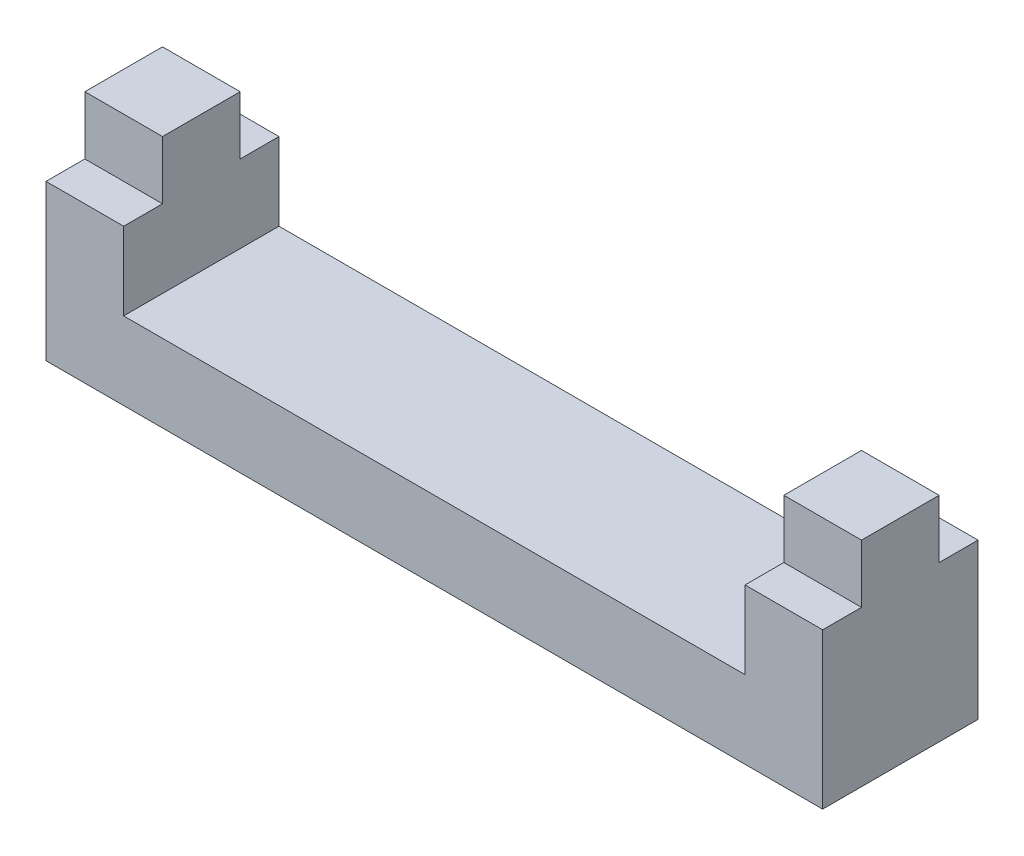
from build123d import *

# Parameters (mm, degrees)
BOSS_EXTRUDE1_DEPTH      = 2
BOSS_EXTRUDE1_DEPTH_BACK = 2
SKETCH2_W                = 1
SKETCH2_H                = 1.5
CUT_EXTRUDE1_DEPTH       = 21.838665984


with BuildPart() as part:
    # Sketch1 → Boss-Extrude1 (new, two sides: drawn at the far end of the back side and taken through both)
    with BuildSketch(Plane.XY.offset(-BOSS_EXTRUDE1_DEPTH_BACK)):
        Polygon((2, 2), (18, 2), (18, 5.5), (20, 5.5), (20, 0), (0, 0), (0, 5.5), (2, 5.5), align=None)
    extrude(amount=BOSS_EXTRUDE1_DEPTH + BOSS_EXTRUDE1_DEPTH_BACK)

    # Sketch2 → Cut-Extrude1 (cut, symmetric)
    with BuildSketch(Plane.ZY):
        with Locations((-1.5, 4.75)):
            Rectangle(SKETCH2_W, SKETCH2_H)
    cut_extrude1 = extrude(amount=CUT_EXTRUDE1_DEPTH, both=True, mode=Mode.SUBTRACT)

    # Mirror1: Cut-Extrude1 across plane
    add(cut_extrude1.mirror(Plane.XY), mode=Mode.SUBTRACT)


solid = part.part
